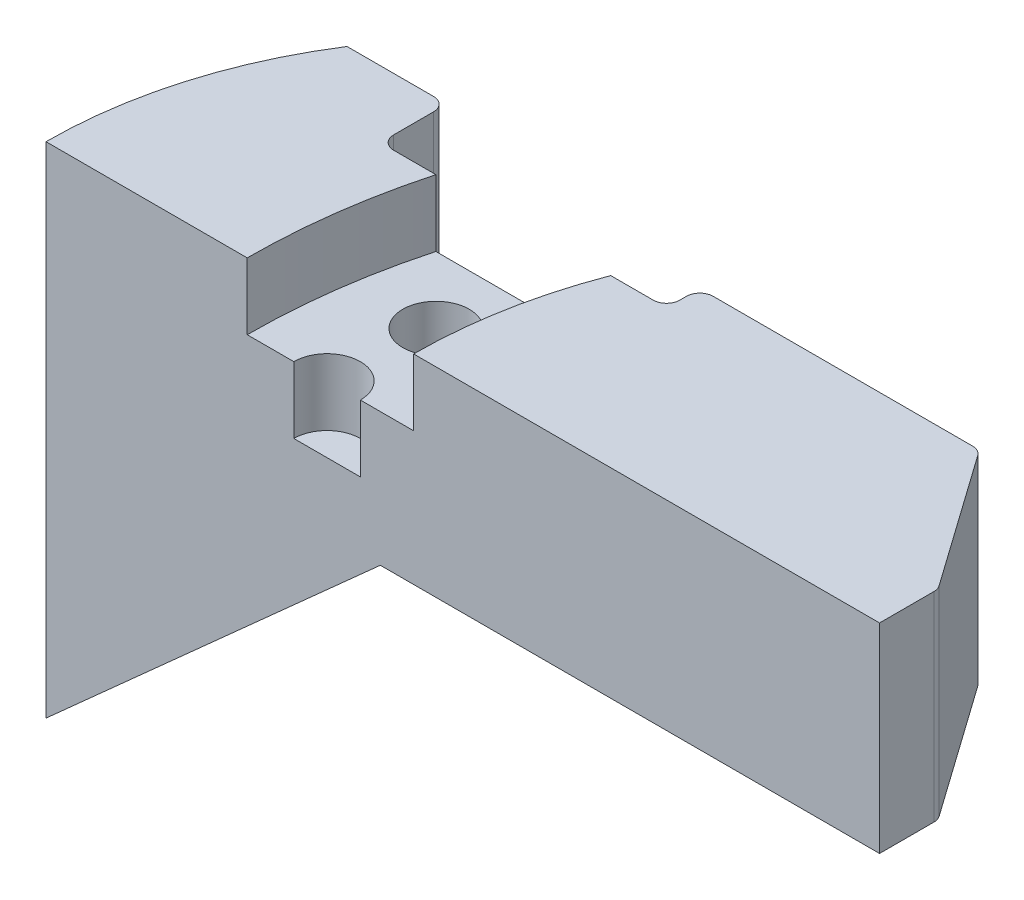
from build123d import *

# Parameters (mm, degrees)
BOSS_EXTRUDE1_DEPTH = 75
SKETCH8_R           = 95
SKETCH8_R_2         = 70
CUT_EXTRUDE6_DEPTH  = 10
SKETCH9_R           = 5
CUT_EXTRUDE7_DEPTH  = 10
BOSS_EXTRUDE2_DEPTH = 75
CUT_EXTRUDE10_DEPTH = 108.26147997


with BuildPart() as part:
    # Sketch1 → Boss-Extrude1 (new body)
    with BuildSketch(Plane(origin=(0, 0, 0), x_dir=(1, 0, 0), z_dir=(0, 1, 0))):
        with BuildLine():
            Line((-58, 0), (57, 0))
            Line((57, 0), (57, 8.158918194))
            ThreePointArc((57, 8.158918194), (56.905987413, 8.764898378), (56.632788017, 9.313908796))
            Line((56.632788017, 9.313908796), (42.597737063, 29.154990602))
            ThreePointArc((42.597737063, 29.154990602), (41.884192973, 29.776229321), (40.964949045, 30))
            Line((40.964949045, 30), (2, 30))
            ThreePointArc((2, 30), (0.585786438, 29.414213562), (0, 28))
            Line((0, 28), (0, 27))
            ThreePointArc((0, 27), (-0.585786438, 25.585786438), (-2, 25))
            Line((-2, 25), (-41, 25))
            ThreePointArc((-41, 25), (-42.414213562, 25.585786438), (-43, 27))
            Line((-43, 27), (-43, 33))
            ThreePointArc((-43, 33), (-43.585786438, 34.414213562), (-45, 35))
            Line((-45, 35), (-58, 35))
            Line((-58, 35), (-58, 0))
        make_face()
    extrude(amount=BOSS_EXTRUDE1_DEPTH)

    # Sketch8 → Cut-Extrude6 (cut)
    with BuildSketch(Plane(origin=(0, 75, 0), x_dir=(1, 0, 0), z_dir=(0, 1, 0))):
        with Locations((57, 0)):
            Circle(SKETCH8_R)
        with Locations((57, 0)):
            Circle(SKETCH8_R_2, mode=Mode.SUBTRACT)
    extrude(amount=-CUT_EXTRUDE6_DEPTH, mode=Mode.SUBTRACT)

    # Sketch9 → Cut-Extrude7 (cut)
    with BuildSketch(Plane(origin=(0, 65, 0), x_dir=(1, 0, 0), z_dir=(0, 1, 0))):
        with Locations((-26, 0)):
            Circle(SKETCH9_R)
        with Locations(Location((-24.633326528, 15, 0), (0, 0, 270))):
            Circle(SKETCH9_R)
    extrude(amount=-CUT_EXTRUDE7_DEPTH, mode=Mode.SUBTRACT)

    # Sketch11 → Boss-Extrude2 (add)
    with BuildSketch(Plane(origin=(0, 75, 0), x_dir=(1, 0, 0), z_dir=(0, 1, 0))):
        with BuildLine():
            Line((-68.227744249, 0), (-58, 0))
            Line((-58, 0), (-58, 35))
            ThreePointArc((-58, 35), (-65.618435157, 18.231886576), (-68.227744249, 0))
        make_face()
    extrude(amount=-BOSS_EXTRUDE2_DEPTH)

    # Sketch12 → Cut-Extrude10 (cut, through all)
    with BuildSketch(Plane.XY):
        Polygon((57, 0), (-68.227744249, 0), (-18, 45), (57, 45), align=None)
    extrude(amount=-CUT_EXTRUDE10_DEPTH, mode=Mode.SUBTRACT)


solid = part.part
